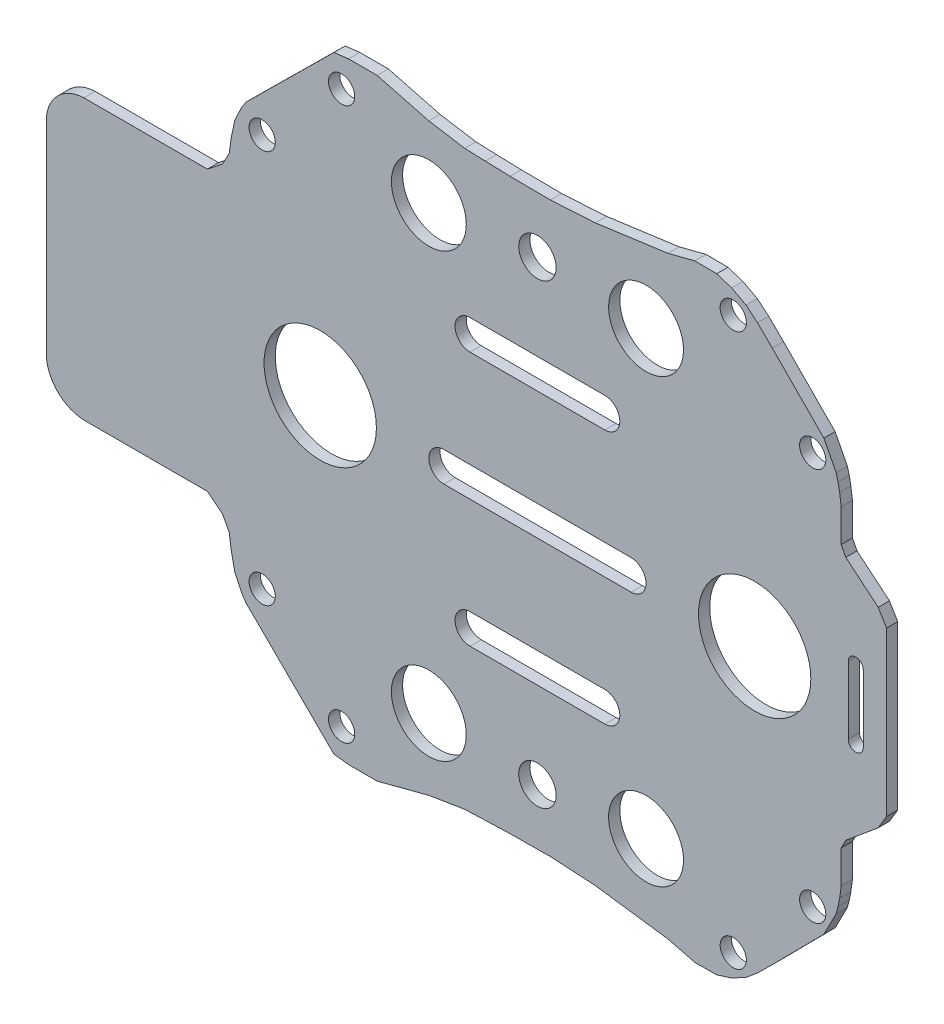
from build123d import *

# Parameters (mm, degrees)
DOWN_BOARD_R    = 7.5
DOWN_BOARD_R_2  = 5
DOWN_BOARD_R_3  = 1.75
DOWN_BOARD_R_4  = 2.5
EXTRUDE_1_DEPTH = 1.5


with BuildPart() as part:
    # down_board → 凸台-拉伸1 (new body)
    with BuildSketch(Plane.XY):
        with BuildLine():
            Line((-65.577840697, 13.426839479), (-65.577840697, -13.426839479))
            ThreePointArc((-65.577840697, -13.426839479), (-64.116315672, -17.044296176), (-60.552102836, -18.631254027))
            Line((-60.552102836, -18.631254027), (-44.068912387, -18.631254027))
            Line((-44.068912387, -18.631254027), (-42.048007576, -20.229937109))
            Line((-42.048007576, -20.229937109), (-41.149136438, -21.908125258))
            Line((-41.149136438, -21.908125258), (-40.892469041, -23.789333182))
            Line((-40.892469041, -23.789333182), (-40.410773876, -26.102659685))
            Line((-40.410773876, -26.102659685), (-39.491433455, -28.071512622))
            Line((-39.491433455, -28.071512622), (-38.897523272, -28.966445774))
            Line((-38.897523272, -28.966445774), (-27.175557076, -40.560652421))
            Line((-27.175557076, -40.560652421), (-25.219810652, -40.800831807))
            Line((-25.219810652, -40.800831807), (-21.399814714, -40.800831807))
            Line((-21.399814714, -40.800831807), (-14.5, -38.99376786))
            Line((-14.5, -38.99376786), (-9.716490487, -38.215139203))
            Line((-9.716490487, -38.215139203), (-6.949583513, -38.111966401))
            Line((-6.949583513, -38.111966401), (-3.647583538, -38.009811446))
            Line((-3.647583538, -38.009811446), (1.739816686, -37.958836623))
            Line((1.739816686, -37.958836623), (7.734475924, -38.316671597))
            Line((7.734475924, -38.316671597), (17.40052023, -39.636214745))
            Line((17.40052023, -39.636214745), (21.017290997, -40.560652421))
            Line((21.017290997, -40.560652421), (23.930160234, -40.533091263))
            Line((23.930160234, -40.533091263), (25.930474181, -39.897299833))
            Line((25.930474181, -39.897299833), (27.847745393, -38.870371024))
            Line((27.847745393, -38.870371024), (29.373346844, -37.598162249))
            Line((29.373346844, -37.598162249), (31.356110551, -35.647675154))
            Line((31.356110551, -35.647675154), (38.246978904, -28.680874548))
            Line((38.246978904, -28.680874548), (39.890534987, -25.492625804))
            Line((39.890534987, -25.492625804), (40.133227927, -24.543113735))
            Line((40.133227927, -24.543113735), (40.347849385, -23.457827058))
            Line((40.347849385, -23.457827058), (40.559404219, -21.908125258))
            Line((40.559404219, -21.908125258), (40.559404219, -17.539392155))
            Line((40.559404219, -17.539392155), (41.168343616, -16.358142371))
            Line((41.168343616, -16.358142371), (42.790589116, -15.005341507))
            Line((42.790589116, -15.005341507), (45.499482621, -12.746377945))
            Line((45.499482621, -12.746377945), (46.605361545, -10.8932302))
            Line((46.605361545, -10.8932302), (46.605361545, 10.8932302))
            Line((46.605361545, 10.8932302), (45.499482621, 12.746377945))
            Line((45.499482621, 12.746377945), (42.790589116, 15.005341507))
            Line((42.790589116, 15.005341507), (41.168343616, 16.358142371))
            Line((41.168343616, 16.358142371), (40.559404219, 17.539392155))
            Line((40.559404219, 17.539392155), (40.559404219, 21.908125258))
            Line((40.559404219, 21.908125258), (40.347849385, 23.457827058))
            Line((40.347849385, 23.457827058), (40.133227927, 24.543113735))
            Line((40.133227927, 24.543113735), (39.890534987, 25.492625804))
            Line((39.890534987, 25.492625804), (38.246978904, 28.680874548))
            Line((38.246978904, 28.680874548), (31.356110551, 35.647675154))
            Line((31.356110551, 35.647675154), (29.373346844, 37.598162249))
            Line((29.373346844, 37.598162249), (27.847745393, 38.870371024))
            Line((27.847745393, 38.870371024), (25.930474181, 39.897299833))
            Line((25.930474181, 39.897299833), (23.930160234, 40.533091263))
            Line((23.930160234, 40.533091263), (21.017290997, 40.560652421))
            Line((21.017290997, 40.560652421), (17.40052023, 39.636214745))
            Line((17.40052023, 39.636214745), (7.734475924, 38.316671597))
            Line((7.734475924, 38.316671597), (1.739816686, 37.958836623))
            Line((1.739816686, 37.958836623), (-3.647583538, 38.009811446))
            Line((-3.647583538, 38.009811446), (-6.949583513, 38.111966401))
            Line((-6.949583513, 38.111966401), (-9.716490487, 38.215139203))
            Line((-9.716490487, 38.215139203), (-14.5, 38.99376786))
            Line((-14.5, 38.99376786), (-21.399814714, 40.800831807))
            Line((-21.399814714, 40.800831807), (-25.219810652, 40.800831807))
            Line((-25.219810652, 40.800831807), (-27.175557076, 40.560652421))
            Line((-27.175557076, 40.560652421), (-38.897523272, 28.966445774))
            Line((-38.897523272, 28.966445774), (-39.491433455, 28.071512622))
            Line((-39.491433455, 28.071512622), (-40.410773876, 26.102659685))
            Line((-40.410773876, 26.102659685), (-40.892469041, 23.789333182))
            Line((-40.892469041, 23.789333182), (-41.149136438, 21.908125258))
            Line((-41.149136438, 21.908125258), (-42.048007576, 20.229937109))
            Line((-42.048007576, 20.229937109), (-44.068912387, 18.631254027))
            Line((-44.068912387, 18.631254027), (-60.552102836, 18.631254027))
            ThreePointArc((-60.552102836, 18.631254027), (-64.116315672, 17.044296176), (-65.577840697, 13.426839479))
        make_face()
        with Locations((-29, 0)):
            Circle(DOWN_BOARD_R, mode=Mode.SUBTRACT)
        with Locations((29, 0)):
            Circle(DOWN_BOARD_R, mode=Mode.SUBTRACT)
        with Locations((-14.5, 29.5)):
            Circle(DOWN_BOARD_R_2, mode=Mode.SUBTRACT)
        with Locations(Location((14.5, 29.5, 0), (0, 0, 180))):
            Circle(DOWN_BOARD_R_2, mode=Mode.SUBTRACT)
        with Locations((14.5, -29.5)):
            Circle(DOWN_BOARD_R_2, mode=Mode.SUBTRACT)
        with Locations(Location((-14.5, -29.5, 0), (0, 0, 180))):
            Circle(DOWN_BOARD_R_2, mode=Mode.SUBTRACT)
        with Locations((-36.75, 26.25)):
            Circle(DOWN_BOARD_R_3, mode=Mode.SUBTRACT)
        with Locations((-26.143398282, 36.856601718)):
            Circle(DOWN_BOARD_R_3, mode=Mode.SUBTRACT)
        with Locations(Location((36.75, 26.25, 0), (0, 0, 180))):
            Circle(DOWN_BOARD_R_3, mode=Mode.SUBTRACT)
        with Locations(Location((26.143398282, 36.856601718, 0), (0, 0, 180))):
            Circle(DOWN_BOARD_R_3, mode=Mode.SUBTRACT)
        with Locations((36.75, -26.25)):
            Circle(DOWN_BOARD_R_3, mode=Mode.SUBTRACT)
        with Locations((26.143398282, -36.856601718)):
            Circle(DOWN_BOARD_R_3, mode=Mode.SUBTRACT)
        with Locations(Location((-36.75, -26.25, 0), (0, 0, 180))):
            Circle(DOWN_BOARD_R_3, mode=Mode.SUBTRACT)
        with Locations(Location((-26.143398282, -36.856601718, 0), (0, 0, 180))):
            Circle(DOWN_BOARD_R_3, mode=Mode.SUBTRACT)
        with Locations((0, -30.5)):
            Circle(DOWN_BOARD_R_4, mode=Mode.SUBTRACT)
        with Locations(Location((0, 30.5, 0), (0, 0, 180))):
            Circle(DOWN_BOARD_R_4, mode=Mode.SUBTRACT)
        with BuildLine():
            Line((-9, -15), (9, -15))
            ThreePointArc((9, -15), (11, -17), (9, -19))
            Line((9, -19), (-9, -19))
            ThreePointArc((-9, -19), (-11, -17), (-9, -15))
        make_face(mode=Mode.SUBTRACT)
        with BuildLine():
            Line((-12.5, 2), (12.5, 2))
            ThreePointArc((12.5, 2), (14.5, 0), (12.5, -2))
            Line((12.5, -2), (-12.5, -2))
            ThreePointArc((-12.5, -2), (-14.5, 0), (-12.5, 2))
        make_face(mode=Mode.SUBTRACT)
        with BuildLine():
            Line((-9, 15), (9, 15))
            ThreePointArc((9, 15), (11, 17), (9, 19))
            Line((9, 19), (-9, 19))
            ThreePointArc((-9, 19), (-11, 17), (-9, 15))
        make_face(mode=Mode.SUBTRACT)
        with BuildLine():
            Line((41.5, -4.5), (41.5, 4.5))
            ThreePointArc((41.5, 4.5), (42.5, 5.5), (43.5, 4.5))
            Line((43.5, 4.5), (43.5, -4.5))
            ThreePointArc((43.5, -4.5), (42.5, -5.5), (41.5, -4.5))
        make_face(mode=Mode.SUBTRACT)
    extrude(amount=EXTRUDE_1_DEPTH)


solid = part.part
